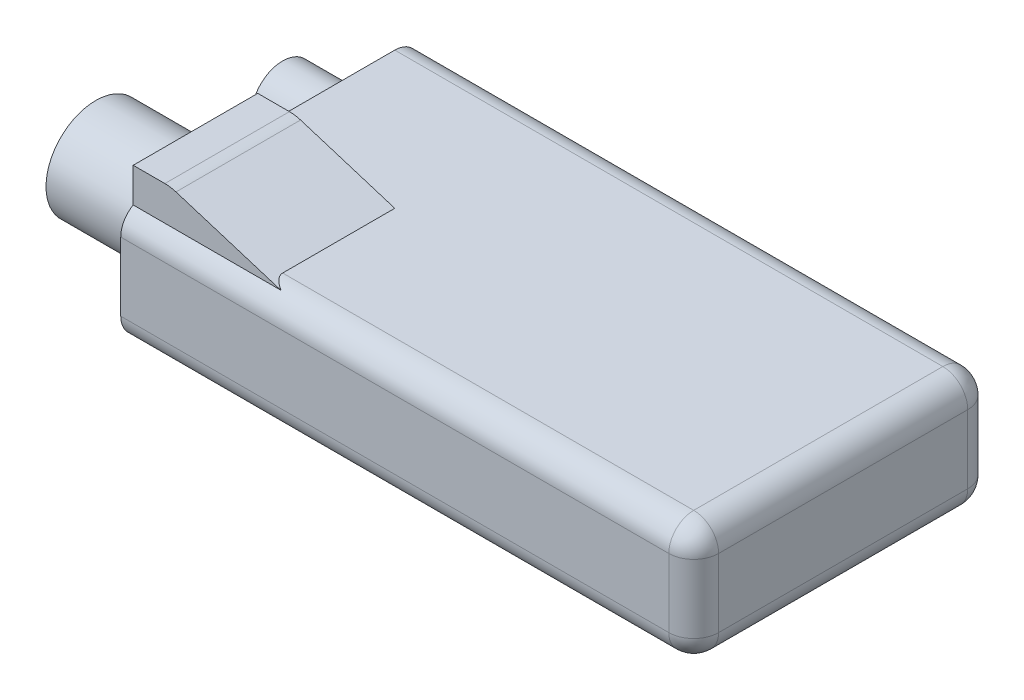
from build123d import *

# Parameters (mm, degrees)
SKETCH_1_W      = 46
SKETCH_1_H      = 24
EXTRUDE_1_DEPTH = 9.5
SKETCH_2_R      = 4
EXTRUDE_2_DEPTH = 8
SKETCH_4_W      = 10
SKETCH_4_H      = 5.984936324
EXTRUDE_3_DEPTH = 3
EXTRUDE_4_DEPTH = 10
SKETCH_6_R      = 2.5
EXTRUDE_5_DEPTH = 6
FILLET_1_R      = 3
FILLET_5_R      = 2
FILLET_6_R      = 2


with BuildPart() as part:
    # 草图1 → 凸台-拉伸1 (new body)
    with BuildSketch(Plane(origin=(0, 0, 0), x_dir=(1, 0, 0), z_dir=(0, 1, 0))):
        Rectangle(SKETCH_1_W, SKETCH_1_H)
    extrude(amount=EXTRUDE_1_DEPTH)

    # 草图2 → 凸台-拉伸2 (add)
    with BuildSketch(Plane.ZY.offset(23)):
        with Locations(Location((6, 6, 0), (0, 0, 118.955024372))):
            Circle(SKETCH_2_R)
    extrude(amount=EXTRUDE_2_DEPTH)

    # 草图4 → 凸台-拉伸3 (add)
    with BuildSketch(Plane.ZY.offset(23)):
        with Locations((6, 9)):
            Rectangle(SKETCH_4_W, SKETCH_4_H)
    extrude(amount=-EXTRUDE_3_DEPTH)

    # 草图5 → 凸台-拉伸4 (add)
    with BuildSketch(Plane.XY.offset(11)):
        Polygon((-20, 11.992468162), (-20, 9.5), (-12, 9.5), align=None)
    extrude(amount=-EXTRUDE_4_DEPTH)

    # 草图6 → 凸台-拉伸5 (add)
    with BuildSketch(Plane.ZY.offset(23)):
        with Locations(Location((-7, 4.749394355, 0), (0, 0, 180))):
            Circle(SKETCH_6_R)
    extrude(amount=EXTRUDE_5_DEPTH)

    # 圆角1
    fillet_1_edges = [part.edges().sort_by_distance(p)[0] for p in [
        (-20, 11.992468162, 6),
    ]]
    fillet(fillet_1_edges, radius=FILLET_1_R)

    # 圆角5
    fillet_5_edges = [part.edges().sort_by_distance(p)[0] for p in [
        (0, 0, 12),
        (0, 0, -12),
        (0, 9.5, -12),
        (0, 9.5, 12),
    ]]
    fillet(fillet_5_edges, radius=FILLET_5_R)

    # 圆角6
    fillet_6_edges = [part.edges().sort_by_distance(p)[0] for p in [
        (23, 4.75, 12),
        (23, 0, 0),
        (23, 4.75, -12),
        (23, 9.5, 0),
        (23, 8.914213562, 11.414213562),
        (23, 8.914213562, -11.414213562),
        (23, 0.585786438, -11.414213562),
        (23, 0.585786438, 11.414213562),
    ]]
    fillet(fillet_6_edges, radius=FILLET_6_R)


solid = part.part
